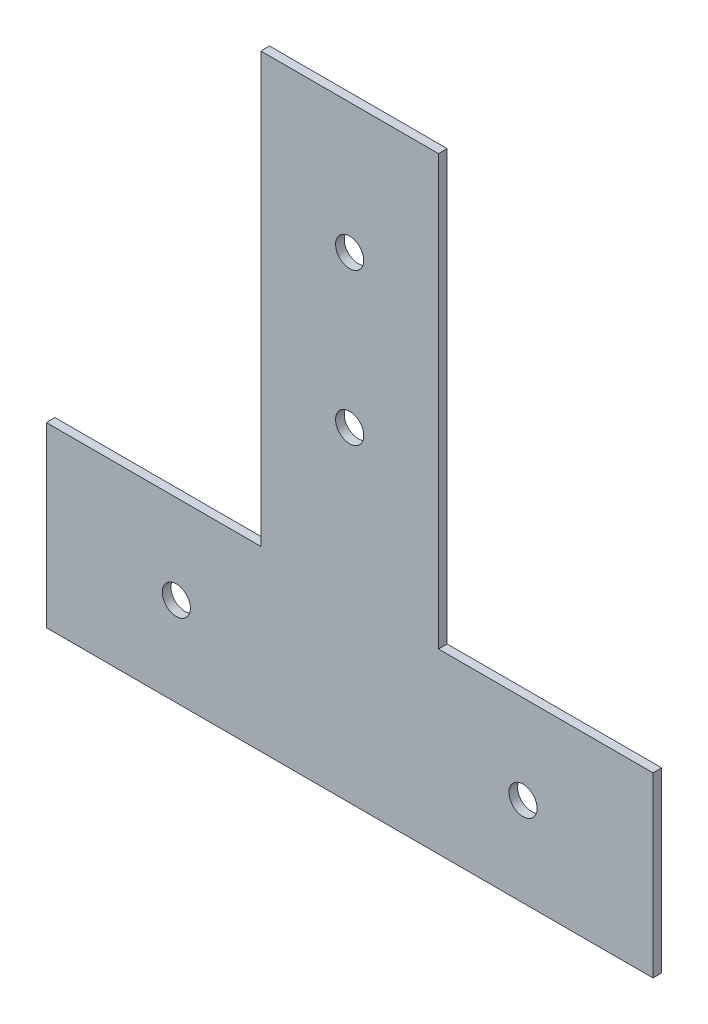
from build123d import *

# Parameters (mm, degrees)
EXTRUDE_1_DEPTH     = 2
SKETCH_2_R          = 3.25
CUT_EXTRUDE_1_DEPTH = 139.507220028


with BuildPart() as part:
    # 草图1 → 凸台-拉伸1 (new body)
    with BuildSketch(Plane.XY):
        Polygon((-70, -20.5), (70, -20.5), (70, 20.5), (20.5, 20.5), (20.5, 119.5), (-20.5, 119.5), (-20.5, 20.5), (-70, 20.5), align=None)
    extrude(amount=EXTRUDE_1_DEPTH)

    # 草图2 → 切除-拉伸1 (cut, through all)
    with BuildSketch(Plane.XY.offset(2)):
        with Locations((0, 89.5)):
            Circle(SKETCH_2_R)
        with Locations((0, 54.5)):
            Circle(SKETCH_2_R)
        with Locations((-40, 0)):
            Circle(SKETCH_2_R)
        with Locations(Location((40, 0, 0), (0, 0, 180))):
            Circle(SKETCH_2_R)
    extrude(amount=-CUT_EXTRUDE_1_DEPTH, mode=Mode.SUBTRACT)


solid = part.part
